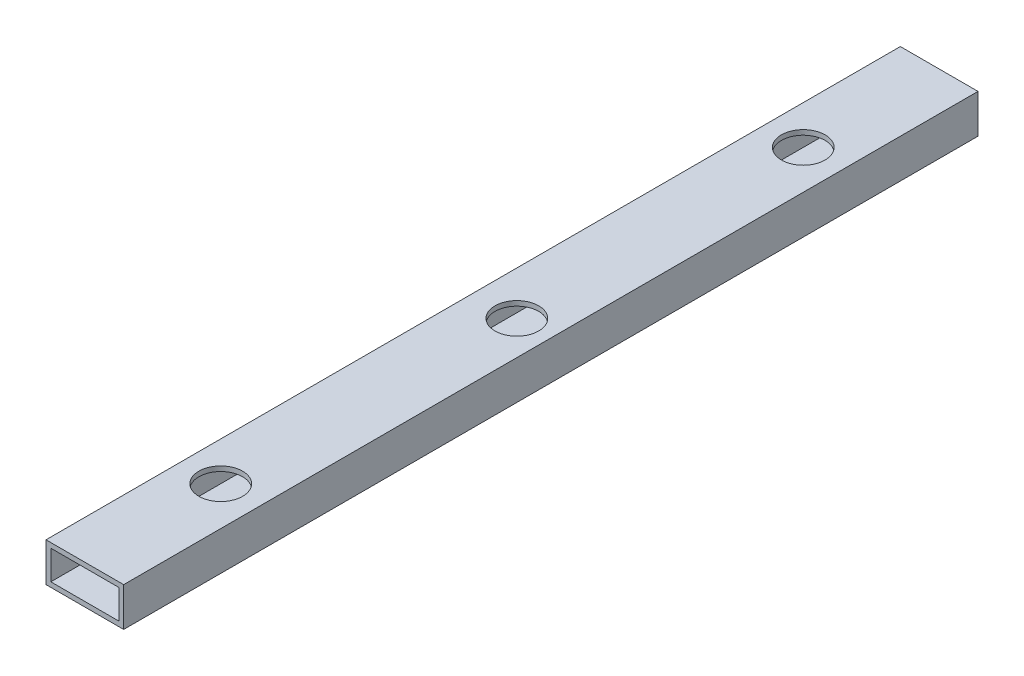
from build123d import *

# Parameters (mm, degrees)
SKETCH1_W           = 50.8
SKETCH1_H           = 25.4
SKETCH1_W_2         = 44.45
SKETCH1_H_2         = 19.05
BOSS_EXTRUDE1_DEPTH = 558.8
SKETCH2_R           = 14.2875
CUT_EXTRUDE1_DEPTH  = 562.678947442


with BuildPart() as part:
    # Sketch1 → Boss-Extrude1 (new body)
    with BuildSketch(Plane.XY):
        with Locations((25.4, 12.7)):
            Rectangle(SKETCH1_W, SKETCH1_H)
        with Locations((25.4, 12.7)):
            Rectangle(SKETCH1_W_2, SKETCH1_H_2, mode=Mode.SUBTRACT)
    extrude(amount=BOSS_EXTRUDE1_DEPTH)

    # Sketch2 → Cut-Extrude1 (cut, through all)
    with BuildSketch(Plane(origin=(0, 25.4, 0), x_dir=(1, 0, 0), z_dir=(0, 1, 0))):
        with Locations(Location((28.575, -279.4, 0), (0, 0, 270))):
            Circle(SKETCH2_R)
        with Locations(Location((25.4, -469.9, 0), (0, 0, 270))):
            Circle(SKETCH2_R)
        with Locations(Location((25.4, -88.9, 0), (0, 0, 90))):
            Circle(SKETCH2_R)
    extrude(amount=-CUT_EXTRUDE1_DEPTH, mode=Mode.SUBTRACT)


solid = part.part
